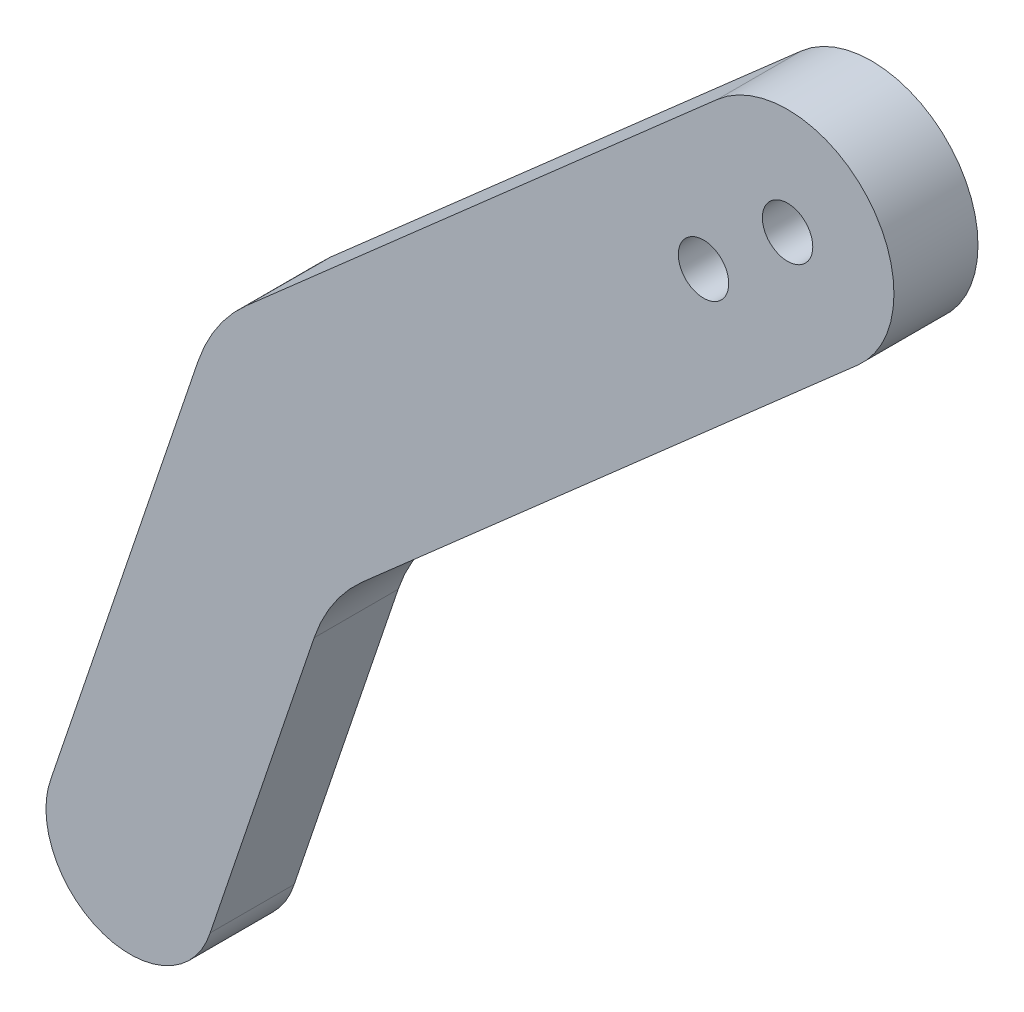
from build123d import *

# Parameters (mm, degrees)
BOSS_EXTRUDE1_DEPTH = 5
SKETCH4_R           = 1.5
CUT_EXTRUDE1_DEPTH  = 7


with BuildPart() as part:
    # Sketch3 → Boss-Extrude1 (new body)
    with BuildSketch(Plane.XY):
        with BuildLine():
            Line((0, 0), (8.749403104, 25.881617161))
            ThreePointArc((8.749403104, 25.881617161), (9.901067951, 28.224372552), (11.619840483, 30.189227692))
            Line((11.619840483, 30.189227692), (39.647968755, 54.831556085))
            ThreePointArc((39.647968755, 54.831556085), (48.581681022, 54.257272818), (48.007397755, 45.323560551))
            Line((48.007397755, 45.323560551), (18.531166812, 19.408060391))
            ThreePointArc((18.531166812, 19.408060391), (16.812394279, 17.44320525), (15.660729432, 15.100449859))
            Line((15.660729432, 15.100449859), (9.473329372, -3.202503804))
            ThreePointArc((9.473329372, -3.202503804), (3.106413686, -6.423698846), (0, 0))
        make_face()
    extrude(amount=BOSS_EXTRUDE1_DEPTH)

    # Sketch4 → Cut-Extrude1 (cut)
    with BuildSketch(Plane.XY.offset(5)):
        with Locations((43.827683255, 50.077558318)):
            Circle(SKETCH4_R)
        with Locations((38.827683255, 45.681558672)):
            Circle(SKETCH4_R)
    extrude(amount=-CUT_EXTRUDE1_DEPTH, mode=Mode.SUBTRACT)


solid = part.part
